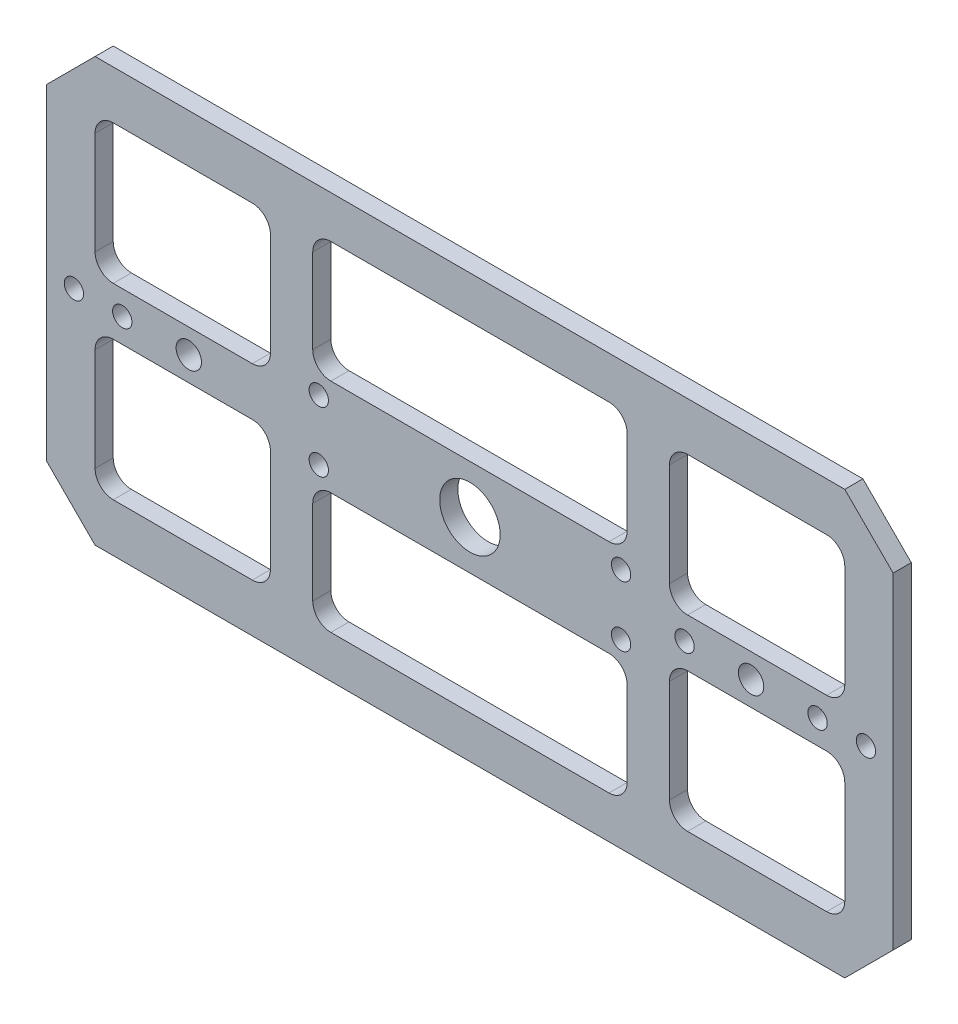
from build123d import *

# Parameters (mm, degrees)
SKETCH_1_W          = 140
SKETCH_1_H          = 70
SKETCH_1_R          = 1.6
SKETCH_1_R_2        = 5
EXTRUDE_1_DEPTH     = 3
SKETCH_2_W          = 29
SKETCH_2_H          = 23
SKETCH_2_W_2        = 52
SKETCH_2_H_2        = 20
CUT_EXTRUDE_1_DEPTH = 79.319856997
FILLET_1_R          = 3
CHAMFER_1_SIZE      = 8
SKETCH_3_R          = 2.1
SKETCH_3_R_2        = 1.6
CUT_EXTRUDE_2_DEPTH = 79.319856997


with BuildPart() as part:
    # 草图1 → 凸台-拉伸1 (new body)
    with BuildSketch(Plane.XY):
        Rectangle(SKETCH_1_W, SKETCH_1_H)
        with Locations((-25, 5)):
            Circle(SKETCH_1_R, mode=Mode.SUBTRACT)
        with Locations((25, 5)):
            Circle(SKETCH_1_R, mode=Mode.SUBTRACT)
        with Locations((-25, -5)):
            Circle(SKETCH_1_R, mode=Mode.SUBTRACT)
        with Locations((25, -5)):
            Circle(SKETCH_1_R, mode=Mode.SUBTRACT)
        Circle(SKETCH_1_R_2, mode=Mode.SUBTRACT)
    extrude(amount=EXTRUDE_1_DEPTH)

    # 草图2 → 切除-拉伸1 (cut, through all)
    with BuildSketch(Plane.XY.offset(3)):
        with Locations((-47.5, 15.5)):
            Rectangle(SKETCH_2_W, SKETCH_2_H)
        with Locations((-47.5, -15.5)):
            Rectangle(SKETCH_2_W, SKETCH_2_H)
        with Locations((47.5, -15.5)):
            Rectangle(SKETCH_2_W, SKETCH_2_H)
        with Locations((47.5, 15.5)):
            Rectangle(SKETCH_2_W, SKETCH_2_H)
        with Locations((0, 18)):
            Rectangle(SKETCH_2_W_2, SKETCH_2_H_2)
        with Locations((0, -18)):
            Rectangle(SKETCH_2_W_2, SKETCH_2_H_2)
    extrude(amount=-CUT_EXTRUDE_1_DEPTH, mode=Mode.SUBTRACT)

    # 圆角1
    fillet_1_edges = [part.edges().sort_by_distance(p)[0] for p in [
        (-62, -27, 1.5),
        (-62, -4, 1.5),
        (-33, -4, 1.5),
        (-33, -27, 1.5),
        (26, 28, 1.5),
        (26, 8, 1.5),
        (-26, 8, 1.5),
        (-26, 28, 1.5),
        (62, -4, 1.5),
        (62, -27, 1.5),
        (33, -27, 1.5),
        (33, -4, 1.5),
        (62, 27, 1.5),
        (62, 4, 1.5),
        (33, 4, 1.5),
        (33, 27, 1.5),
        (26, -8, 1.5),
        (26, -28, 1.5),
        (-26, -28, 1.5),
        (-26, -8, 1.5),
        (-62, 4, 1.5),
        (-62, 27, 1.5),
        (-33, 27, 1.5),
        (-33, 4, 1.5),
    ]]
    fillet(fillet_1_edges, radius=FILLET_1_R)

    # 倒角1
    chamfer_1_edges = [part.edges().sort_by_distance(p)[0] for p in [
        (-70, 35, 1.5),
        (70, 35, 1.5),
        (70, -35, 1.5),
        (-70, -35, 1.5),
    ]]
    chamfer(chamfer_1_edges, length=CHAMFER_1_SIZE)

    # 草图3 → 切除-拉伸2 (cut, through all)
    with BuildSketch(Plane.XY.offset(3)):
        with Locations((-46.5, 0)):
            Circle(SKETCH_3_R)
        with Locations((46.5, 0)):
            Circle(SKETCH_3_R)
        with Locations((-57.5, 0)):
            Circle(SKETCH_3_R_2)
        with Locations(Location((57.5, 0, 0), (0, 0, 180))):
            Circle(SKETCH_3_R_2)
        with Locations(Location((35.5, 0, 0), (0, 0, 180))):
            Circle(SKETCH_3_R_2)
        with Locations((-65.5, 0)):
            Circle(SKETCH_3_R_2)
        with Locations(Location((65.5, 0, 0), (0, 0, 180))):
            Circle(SKETCH_3_R_2)
    extrude(amount=-CUT_EXTRUDE_2_DEPTH, mode=Mode.SUBTRACT)


solid = part.part
